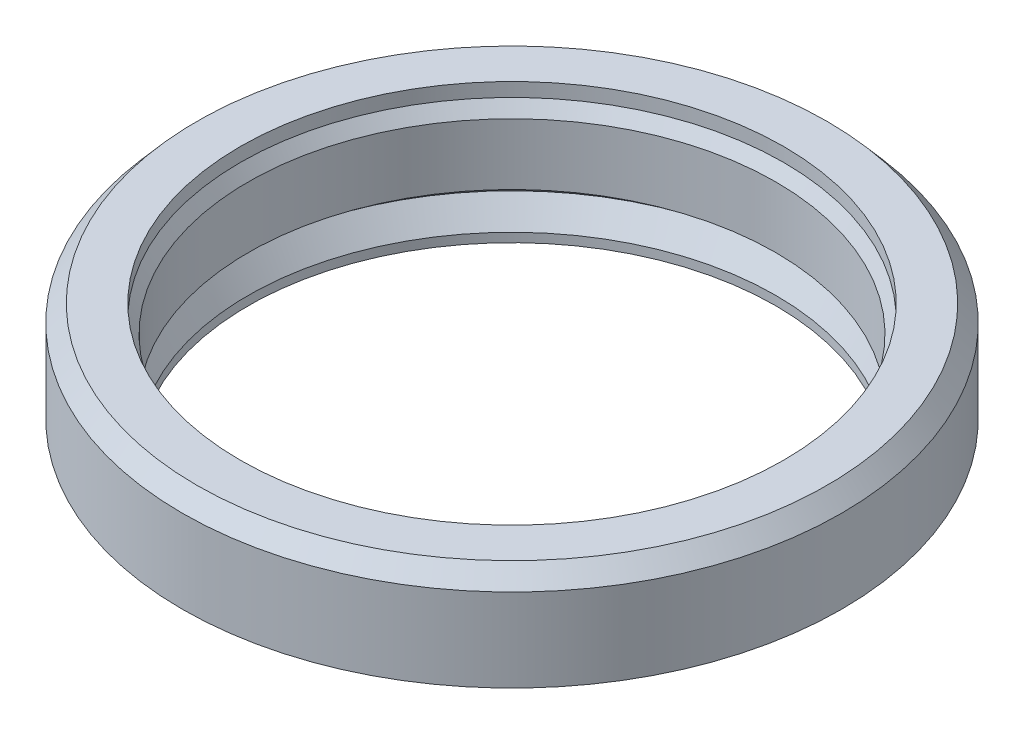
from build123d import *

# Parameters (mm, degrees)
REDONDEO1_R = 0.5


with BuildPart() as part:
    # Croquis1 → Revolución1 (revolve)
    with BuildSketch(Plane.XY, mode=Mode.PRIVATE) as revoluci_n1_sk:
        Polygon((-8, 1.873006462), (-8, 3.730556499), (-8.240342635, 4.120291582), (-8.240342635, 4.539307424), (-9.558967924, 4.539307424), (-9.999624488, 4.02630535), (-9.999624488, 1.503449512), (-8.897118424, 1.503449512), (-8.250134341, 0.475546819), (-8, 0.475546819), (-8, 0.749389269), (-8.474621749, 1.503449512), align=None)
    revolve(revoluci_n1_sk.sketch.rotate(Axis((0, 26.098695966, 0), (0, -1, 0)), 270), axis=Axis((0, 26.098695966, 0), (0, -1, 0)))

    # Redondeo1
    redondeo1_edges = [part.edges().sort_by_distance(p)[0] for p in [
        (0, 1.503449512, -8.897118424),
    ]]
    fillet(redondeo1_edges, radius=REDONDEO1_R)


solid = part.part
